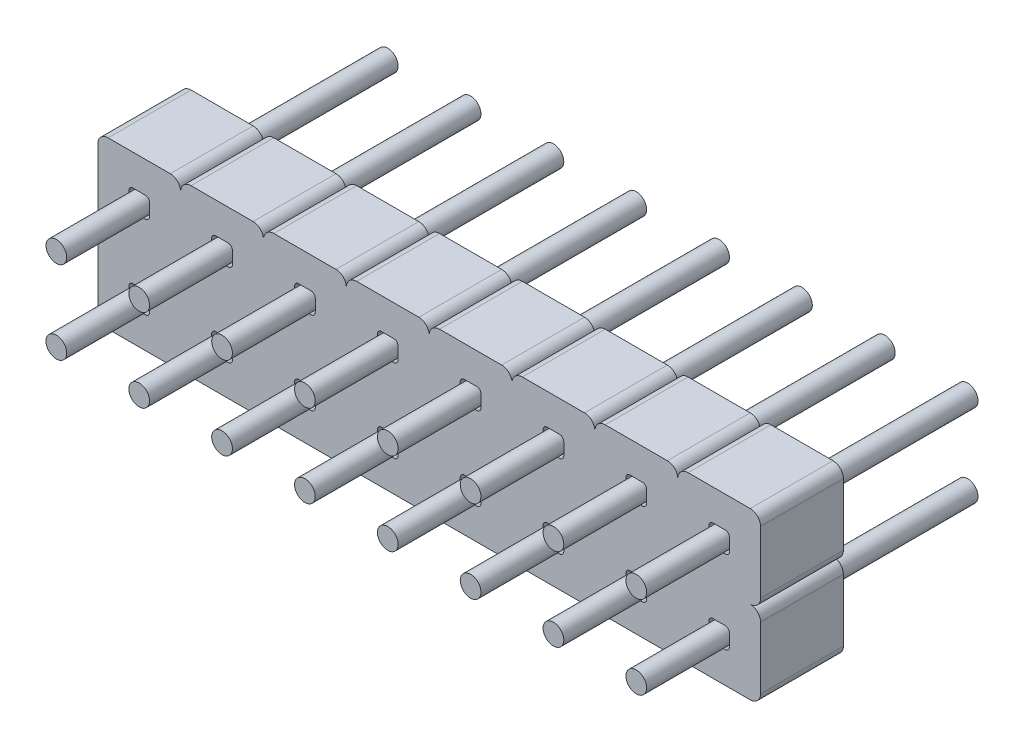
from build123d import *

# Parameters (mm, degrees)
EXTRUDE_1_DEPTH             = 2
PATTERN_LINEAR_2_COUNT      = 8
PATTERN_LINEAR_2_PITCH      = 2
PATTERN_LINEAR_2_COUNT_DIR2 = 2
PATTERN_LINEAR_2_PITCH_DIR2 = 2
SKETCH_3_R                  = 0.25
EXTRUDE_2_DEPTH             = 4
PATTERN_LINEAR_3_COUNT      = 8
PATTERN_LINEAR_3_PITCH      = 2
PATTERN_LINEAR_3_COUNT_DIR2 = 2
PATTERN_LINEAR_3_PITCH_DIR2 = 2


with BuildPart() as part:
    # 草图1 → 凸台-拉伸1 (new body)
    with BuildSketch(Plane.XY):
        with BuildLine():
            Line((0.25, 0), (1.75, 0))
            ThreePointArc((1.75, 0), (1.926776695, -0.073223305), (2, -0.25))
            Line((2, -0.25), (2, -1.75))
            ThreePointArc((2, -1.75), (1.926776695, -1.926776695), (1.75, -2))
            Line((1.75, -2), (0.25, -2))
            ThreePointArc((0.25, -2), (0.073223305, -1.926776695), (0, -1.75))
            Line((0, -1.75), (0, -0.25))
            ThreePointArc((0, -0.25), (0.073223305, -0.073223305), (0.25, 0))
        make_face()
        with BuildLine():
            Line((0.85, -0.75), (1.15, -0.75))
            ThreePointArc((1.15, -0.75), (1.220710678, -0.779289322), (1.25, -0.85))
            Line((1.25, -0.85), (1.25, -1.15))
            ThreePointArc((1.25, -1.15), (1.220710678, -1.220710678), (1.15, -1.25))
            Line((1.15, -1.25), (0.85, -1.25))
            ThreePointArc((0.85, -1.25), (0.779289322, -1.220710678), (0.75, -1.15))
            Line((0.75, -1.15), (0.75, -0.85))
            ThreePointArc((0.75, -0.85), (0.779289322, -0.779289322), (0.85, -0.75))
        make_face(mode=Mode.SUBTRACT)
    extrude_1 = extrude(amount=EXTRUDE_1_DEPTH)

    # 阵列(线性)2: Extrude 1 8 × 2
    with Locations(*[(i * PATTERN_LINEAR_2_PITCH, -j * PATTERN_LINEAR_2_PITCH_DIR2, 0) for i in range(PATTERN_LINEAR_2_COUNT) for j in range(PATTERN_LINEAR_2_COUNT_DIR2) if (i, j) != (0, 0)]):
        add(extrude_1)


with BuildPart() as body_2:
    # 草图3 → 凸台-拉伸2 (new, symmetric)
    with BuildSketch(Plane(origin=(0, 0, 0), x_dir=(-1, 0, 0), z_dir=(0, 0, -1))):
        with Locations((-1, -1)):
            Circle(SKETCH_3_R)
    extrude_2 = extrude(amount=EXTRUDE_2_DEPTH, both=True)


with BuildPart() as pattern_linear_3_1:
    # 阵列(线性)3: Extrude 2 8 × 2
    with Locations(*[(i * PATTERN_LINEAR_3_PITCH, -j * PATTERN_LINEAR_3_PITCH_DIR2, 0) for i in range(PATTERN_LINEAR_3_COUNT) for j in range(PATTERN_LINEAR_3_COUNT_DIR2) if (i, j) != (0, 0)]):
        add(extrude_2)


solid = Compound([part.part, body_2.part, pattern_linear_3_1.part])
